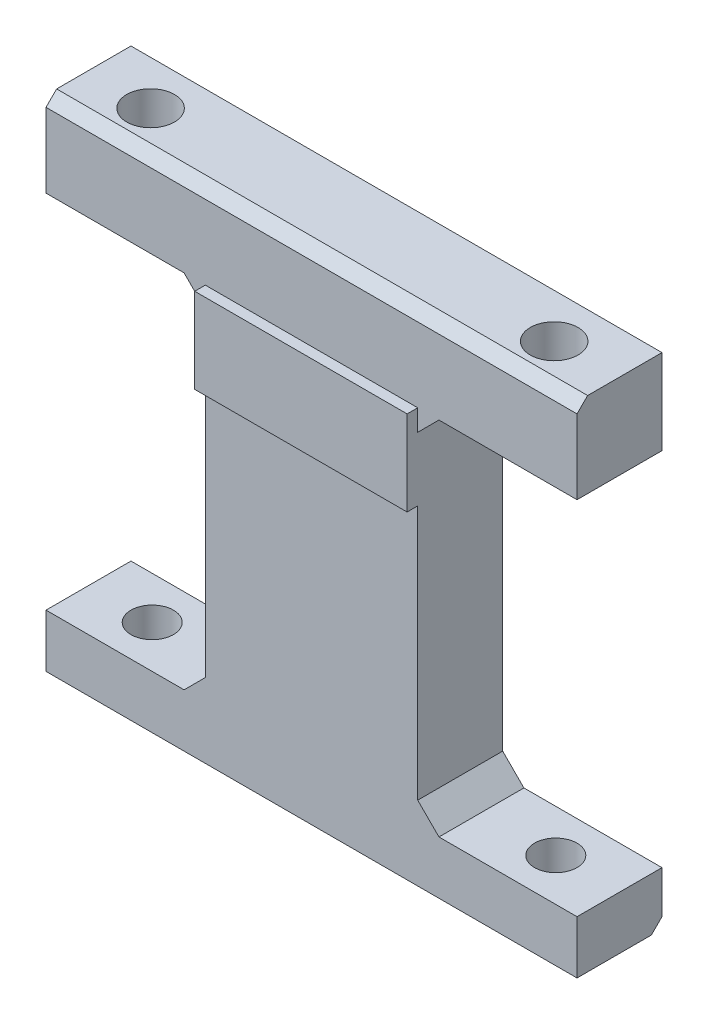
from build123d import *

# Parameters (mm, degrees)
SKETCH_1_W          = 50
SKETCH_1_H          = 8
EXTRUDE_1_DEPTH     = 8
SKETCH_2_R          = 2
CUT_EXTRUDE_1_DEPTH = 8
SKETCH_3_W          = 20
SKETCH_3_H          = 8
EXTRUDE_2_DEPTH     = 1
SKETCH_4_R          = 2.25
CUT_EXTRUDE_2_DEPTH = 10
SKETCH_4_3_R        = 2.25
CUT_EXTRUDE_3_DEPTH = 10
CHAMFER_1_SIZE      = 2
CHAMFER_2_SIZE      = 1
CHAMFER_3_SIZE      = 1


with BuildPart() as part:
    # ｽｹｯﾁ1 → ﾎﾞｽ - 押し出し1 (new body)
    with BuildSketch(Plane.XY):
        Polygon((0, 0), (25, 0), (25, 5), (-25, 5), (-25, 0), align=None)
        Polygon((0, 5), (10, 5), (10, 39), (-10, 39), (-10, 5), align=None)
        with Locations((0, 43)):
            Rectangle(SKETCH_1_W, SKETCH_1_H)
    extrude(amount=-EXTRUDE_1_DEPTH)

    # ｽｹｯﾁ2 → ｶｯﾄ - 押し出し1 (cut)
    with BuildSketch(Plane(origin=(0, 5, 0), x_dir=(1, 0, 0), z_dir=(0, 1, 0))):
        with Locations((19, 4)):
            Circle(SKETCH_2_R)
        with Locations((-19, 4)):
            Circle(SKETCH_2_R)
    extrude(amount=-CUT_EXTRUDE_1_DEPTH, mode=Mode.SUBTRACT)

    # ｽｹｯﾁ3 → ﾎﾞｽ - 押し出し2 (add)
    with BuildSketch(Plane.XY):
        with Locations((0, 35)):
            Rectangle(SKETCH_3_W, SKETCH_3_H)
    extrude(amount=EXTRUDE_2_DEPTH)

    # ｽｹｯﾁ4 → ｶｯﾄ - 押し出し2 (cut)
    with BuildSketch(Plane(origin=(0, 47, 0), x_dir=(1, 0, 0), z_dir=(0, 1, 0))):
        with Locations((19, 3.847406514)):
            Circle(SKETCH_4_R)
    extrude(amount=-CUT_EXTRUDE_2_DEPTH, mode=Mode.SUBTRACT)

    # ｽｹｯﾁ4<3> → ｶｯﾄ - 押し出し3 (cut)
    with BuildSketch(Plane(origin=(0, 47, 0), x_dir=(1, 0, 0), z_dir=(0, 1, 0))):
        with Locations((19, 3.847406514)):
            Circle(SKETCH_4_3_R)
        with Locations((-19, 3.847406514)):
            Circle(SKETCH_4_3_R)
    extrude(amount=-CUT_EXTRUDE_3_DEPTH, mode=Mode.SUBTRACT)

    # 面取り1
    chamfer_1_edges = [part.edges().sort_by_distance(p)[0] for p in [
        (10, 39, -4),
        (-10, 39, -4),
        (10, 5, -4),
        (-10, 5, -4),
    ]]
    chamfer(chamfer_1_edges, length=CHAMFER_1_SIZE)

    # 面取り2
    chamfer_2_edges = [part.edges().sort_by_distance(p)[0] for p in [
        (0, 47, 0),
    ]]
    chamfer(chamfer_2_edges, length=CHAMFER_2_SIZE)

    # 面取り3
    chamfer_3_edges = [part.edges().sort_by_distance(p)[0] for p in [
        (0, 0, -8),
    ]]
    chamfer(chamfer_3_edges, length=CHAMFER_3_SIZE)


solid = part.part
